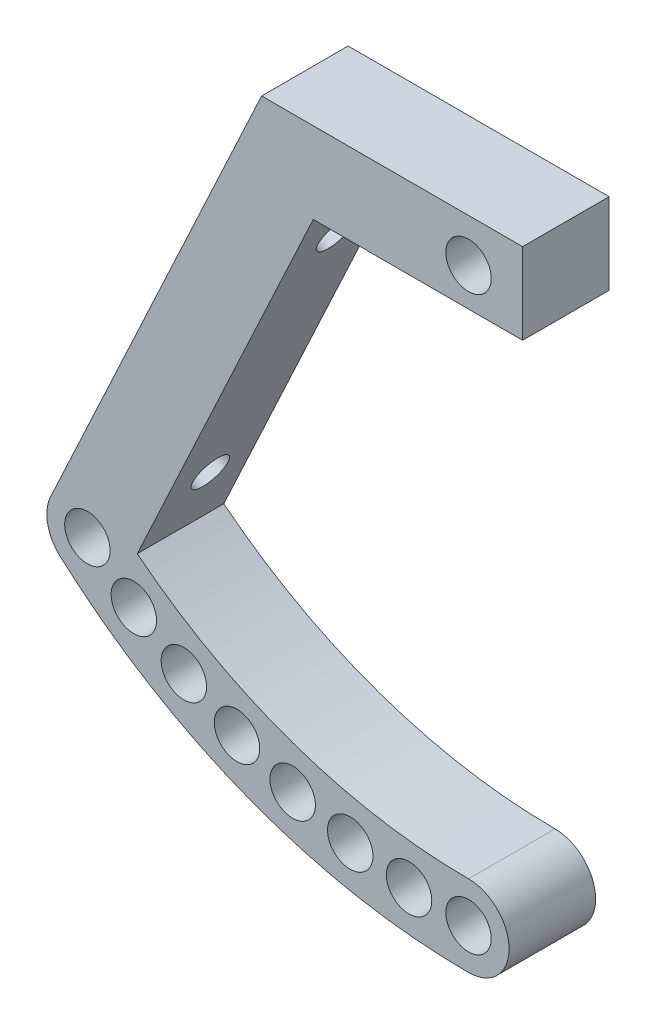
from build123d import *

# Parameters (mm, degrees)
SKETCH1_R           = 2.1
BOSS_EXTRUDE1_DEPTH = 8
CUT_EXTRUDE1_REACH  = 80.167
SKETCH2_R           = 1.65


with BuildPart() as part:
    # Sketch1 → Boss-Extrude1 (new body)
    # profile 1 of 5: a face of its own
    with BuildSketch(Plane.XY):
        Polygon((-14.353967242, 72.5), (5, 72.5), (5, 80), (-19.131994198, 80), (-12.334685795, 76.830363037), align=None)
        with Locations((0, 76)):
            Circle(SKETCH1_R, mode=Mode.SUBTRACT)
    # profile 2 of 5: a face of its own
    with BuildSketch(Plane.XY):
        Polygon((-19.131994198, 72.5), (-14.353967242, 72.5), (-12.334685795, 76.830363037), (-19.131994198, 80), align=None)
    # profile 3 of 5: a face of its own
    with BuildSketch(Plane.XY):
        with BuildLine():
            Line((-30.628506806, 37.599137276), (-14.353967242, 72.5))
            Line((-14.353967242, 72.5), (-19.131994198, 72.5))
            Line((-19.131994198, 72.5), (-19.131994198, 80))
            Line((-19.131994198, 80), (-38.637128487, 38.171104532))
            ThreePointArc((-38.637128487, 38.171104532), (-35.992554118, 40.259685439), (-32.739034841, 39.381872183))
            ThreePointArc((-32.739034841, 39.381872183), (-31.696306875, 38.475663662), (-30.628506806, 37.599137276))
        make_face()
    # profile 4 of 5: a face of its own
    with BuildSketch(Plane.XY):
        with BuildLine():
            Line((-31.819822815, 35.044351851), (-30.628506806, 37.599137276))
            ThreePointArc((-30.628506806, 37.599137276), (-31.696306875, 38.475663662), (-32.739034841, 39.381872183))
            ThreePointArc((-32.739034841, 39.381872183), (-35.992554118, 40.259685439), (-38.637128487, 38.171104532))
            ThreePointArc((-38.637128487, 38.171104532), (-38.911873793, 35.832206175), (-37.737913805, 33.790699757))
            ThreePointArc((-37.737913805, 33.790699757), (-37.315296786, 33.416625413), (-36.888971991, 33.046782299))
            Line((-36.888971991, 33.046782299), (-33.490317789, 31.461963818))
            Line((-33.490317789, 31.461963818), (-32.97126033, 32.575086132))
            ThreePointArc((-32.97126033, 32.575086132), (-32.850330683, 34.021790637), (-31.819822815, 35.044351851))
        make_face()
        with Locations((-35.238474323, 36.58628597)):
            Circle(SKETCH1_R, mode=Mode.SUBTRACT)
    # profile 5 of 5: a face of its own
    with BuildSketch(Plane.XY):
        with BuildLine():
            ThreePointArc((0, 26.880434783), (-16.224950018, 29.637486219), (-30.628506806, 37.599137276))
            Line((-30.628506806, 37.599137276), (-31.819822815, 35.044351851))
            ThreePointArc((-31.819822815, 35.044351851), (-29.811908313, 34.901033754), (-28.847084331, 33.134292287))
            ThreePointArc((-28.847084331, 33.134292287), (-30.664922673, 31.053334623), (-32.97126033, 32.575086132))
            Line((-32.97126033, 32.575086132), (-33.490317789, 31.461963818))
            Line((-33.490317789, 31.461963818), (-36.888971991, 33.046782299))
            ThreePointArc((-36.888971991, 33.046782299), (-19.669553306, 22.906838122), (0, 19.380434783))
            ThreePointArc((0, 19.380434783), (3.75, 23.130434783), (0, 26.880434783))
        make_face()
        with Locations((-26.319869018, 30.147460036)):
            Circle(SKETCH1_R, mode=Mode.SUBTRACT)
        with Locations((-21.407041065, 27.658201118)):
            Circle(SKETCH1_R, mode=Mode.SUBTRACT)
        with Locations((-16.261912507, 25.693527972)):
            Circle(SKETCH1_R, mode=Mode.SUBTRACT)
        with Locations((-10.940316211, 24.274760441)):
            Circle(SKETCH1_R, mode=Mode.SUBTRACT)
        with Locations((-5.5, 23.417294418)):
            Circle(SKETCH1_R, mode=Mode.SUBTRACT)
        with Locations((0, 23.130434783)):
            Circle(SKETCH1_R, mode=Mode.SUBTRACT)
    extrude(amount=BOSS_EXTRUDE1_DEPTH)

    # Sketch2 → Cut-Extrude1 (cut, up to next)
    with BuildSketch(Plane(origin=(-46.356679233, 21.616474533, 0), x_dir=(0, 0, 1), z_dir=(-0.906307787036651, 0.42261826174069733, 0)), mode=Mode.PRIVATE) as cut_extrude1_sk1:
        with Locations(Location((4, 55.04255297, 0), (0, 0, 270))):
            Circle(SKETCH2_R)
    cut_extrude1_tool1 = extrude(cut_extrude1_sk1.sketch, amount=-CUT_EXTRUDE1_REACH, mode=Mode.PRIVATE) & part.part
    # Sketch2 → Cut-Extrude1 (cut, up to next)
    with BuildSketch(Plane(origin=(-46.356679233, 21.616474533, 0), x_dir=(0, 0, 1), z_dir=(-0.906307787036651, 0.42261826174069733, 0)), mode=Mode.PRIVATE) as cut_extrude1_sk2:
        with Locations(Location((4, 27.64255297, 0), (0, 0, 270))):
            Circle(SKETCH2_R)
    cut_extrude1_tool2 = extrude(cut_extrude1_sk2.sketch, amount=-CUT_EXTRUDE1_REACH, mode=Mode.PRIVATE) & part.part
    add(cut_extrude1_tool1.solids().sort_by_distance((-23.094691, 71.501969, 4))[0], mode=Mode.SUBTRACT)
    add(cut_extrude1_tool2.solids().sort_by_distance((-34.674432, 46.669136, 4))[0], mode=Mode.SUBTRACT)


solid = part.part
